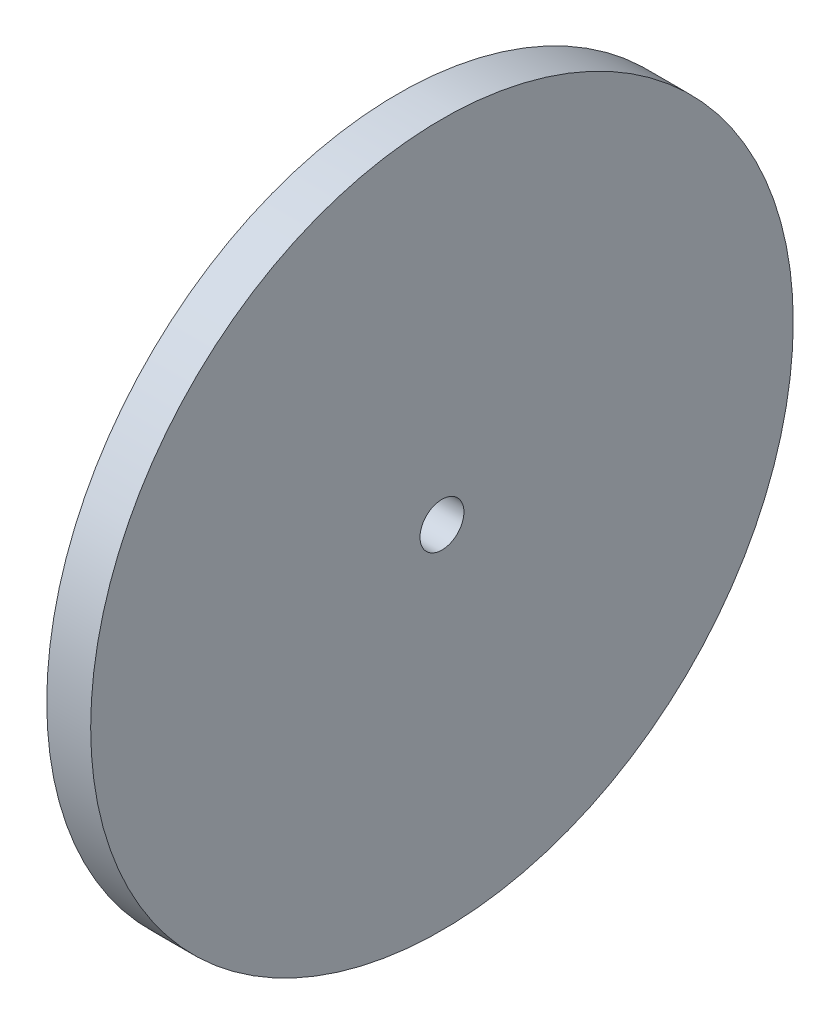
from build123d import *

# Parameters (mm, degrees)
SKETCH1_R           = 40
BOSS_EXTRUDE1_DEPTH = 5
SKETCH2_R           = 2.5
CUT_EXTRUDE1_DEPTH  = 5


with BuildPart() as part:
    # Sketch1 → Boss-Extrude1 (new body)
    with BuildSketch(Plane(origin=(0, 0, 0), x_dir=(0, 0, -1), z_dir=(1, 0, 0))):
        Circle(SKETCH1_R)
    extrude(amount=BOSS_EXTRUDE1_DEPTH)

    # Sketch2 → Cut-Extrude1 (cut)
    with BuildSketch(Plane(origin=(5, 0, 0), x_dir=(0, 0, -1), z_dir=(1, 0, 0))):
        Circle(SKETCH2_R)
    extrude(amount=-CUT_EXTRUDE1_DEPTH, mode=Mode.SUBTRACT)


solid = part.part
